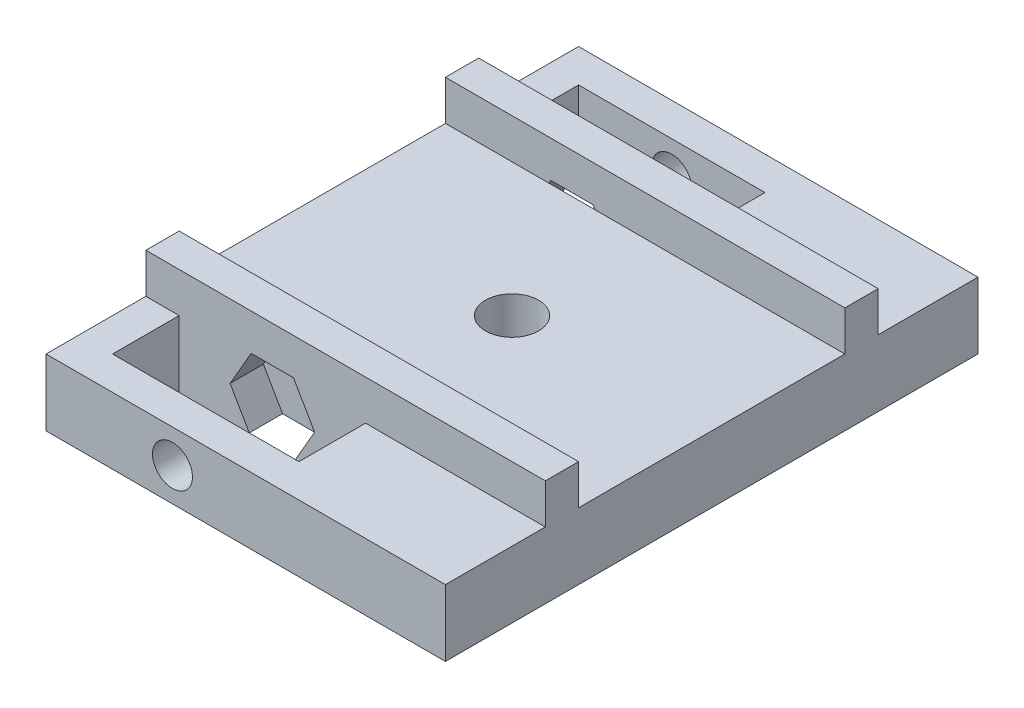
from build123d import *

# Parameters (mm, degrees)
SKETCH1_W           = 30
SKETCH1_H           = 32.5
SKETCH1_W_2         = 14
SKETCH1_H_2         = 5
BOSS_EXTRUDE1_DEPTH = 5
SKETCH1_3_W         = 30
SKETCH1_3_H         = 2.5
BOSS_EXTRUDE2_DEPTH = 8
SKETCH3_R           = 1.5
CUT_EXTRUDE2_DEPTH  = 2.5
CUT_EXTRUDE3_DEPTH  = 2.5
SKETCH2_R           = 2
CUT_EXTRUDE1_DEPTH  = 43.720018727
CUT_EXTRUDE4_DEPTH  = 2.5


with BuildPart() as part:
    # Sketch1 → Boss-Extrude1 (new body)
    with BuildSketch(Plane(origin=(0, 0, 0), x_dir=(1, 0, 0), z_dir=(0, 1, 0))):
        with Locations((-15, -6.25)):
            Rectangle(SKETCH1_W, SKETCH1_H)
        with Locations((-20.5, 5)):
            Rectangle(SKETCH1_W_2, SKETCH1_H_2, mode=Mode.SUBTRACT)
    boss_extrude1 = extrude(amount=BOSS_EXTRUDE1_DEPTH)

    # Sketch1<3> → Boss-Extrude2 (add)
    with BuildSketch(Plane(origin=(0, 0, 0), x_dir=(1, 0, 0), z_dir=(0, 1, 0))):
        with Locations((-15, -21.25)):
            Rectangle(SKETCH1_3_W, SKETCH1_3_H)
        with Locations((-15, 1.25)):
            Rectangle(SKETCH1_3_W, SKETCH1_3_H)
    extrude(amount=BOSS_EXTRUDE2_DEPTH)

    # Sketch3 → Cut-Extrude2 (cut)
    with BuildSketch(Plane(origin=(0, 0, -10), x_dir=(-1, 0, 0), z_dir=(0, 0, -1))):
        with Locations((20.5, 2.5)):
            Circle(SKETCH3_R)
    cut_extrude2 = extrude(amount=-CUT_EXTRUDE2_DEPTH, mode=Mode.SUBTRACT)

    # Sketch4 → Cut-Extrude3 (cut)
    with BuildSketch(Plane(origin=(0, 0, -2.5), x_dir=(-1, 0, 0), z_dir=(0, 0, -1))):
        Polygon((22.08771324, -0.25), (23.675426481, 2.5), (22.08771324, 5.25), (18.91228676, 5.25), (17.324573519, 2.5), (18.91228676, -0.25), align=None)
    cut_extrude3 = extrude(amount=-CUT_EXTRUDE3_DEPTH, mode=Mode.SUBTRACT)

    # Mirror1: Boss-Extrude1, Cut-Extrude2, Cut-Extrude3 across plane
    add(boss_extrude1.mirror(Plane(origin=(0, 0, 10), x_dir=(1, 0, 0), z_dir=(0, 0, -1))))
    add(cut_extrude2.mirror(Plane(origin=(0, 0, 10), x_dir=(1, 0, 0), z_dir=(0, 0, -1))), mode=Mode.SUBTRACT)
    add(cut_extrude3.mirror(Plane(origin=(0, 0, 10), x_dir=(1, 0, 0), z_dir=(0, 0, -1))), mode=Mode.SUBTRACT)

    # Sketch2 → Cut-Extrude1 (cut, through all)
    with BuildSketch(Plane(origin=(0, 5, 0), x_dir=(1, 0, 0), z_dir=(0, 1, 0))):
        with Locations((-15, -10)):
            Circle(SKETCH2_R)
    extrude(amount=-CUT_EXTRUDE1_DEPTH, mode=Mode.SUBTRACT)

    # Sketch4<3> → Cut-Extrude4 (cut)
    with BuildSketch(Plane(origin=(0, 0, -2.5), x_dir=(-1, 0, 0), z_dir=(0, 0, -1))):
        Polygon((22.232050808, 0), (23.675426481, 2.5), (22.08771324, 5.25), (18.91228676, 5.25), (17.324573519, 2.5), (18.767949192, 0), align=None)
    extrude(amount=-CUT_EXTRUDE4_DEPTH, mode=Mode.SUBTRACT)


solid = part.part
